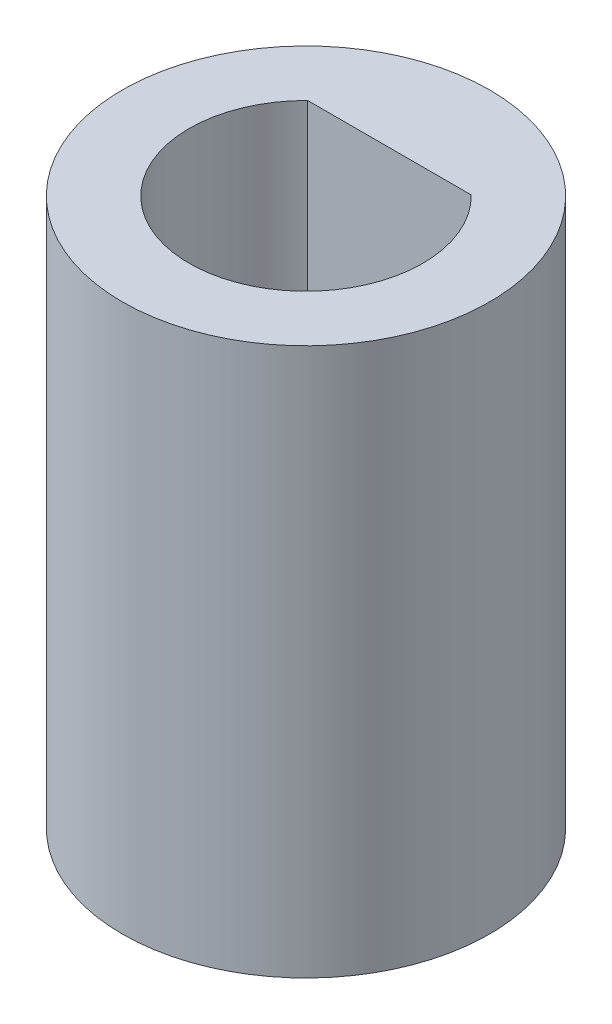
from build123d import *

# Parameters (mm, degrees)
SKETCH1_R           = 5.5
BOSS_EXTRUDE1_DEPTH = 16.4
CUT_EXTRUDE1_DEPTH  = 19.151033028


with BuildPart() as part:
    # Sketch1 → Boss-Extrude1 (new body)
    with BuildSketch(Plane(origin=(0, 0, 0), x_dir=(1, 0, 0), z_dir=(0, 1, 0))):
        with Locations(Location((0, 0, 0), (0, 0, 270))):
            Circle(SKETCH1_R)
    extrude(amount=-BOSS_EXTRUDE1_DEPTH)

    # Sketch3 → Cut-Extrude1 (cut, through all)
    with BuildSketch(Plane(origin=(0, 0, 0), x_dir=(1, 0, 0), z_dir=(0, 1, 0))):
        with BuildLine():
            Line((-2.449489743, 2.5), (2.449489743, 2.5))
            ThreePointArc((2.449489743, 2.5), (0, -3.5), (-2.449489743, 2.5))
        make_face()
    extrude(amount=-CUT_EXTRUDE1_DEPTH, mode=Mode.SUBTRACT)


solid = part.part
